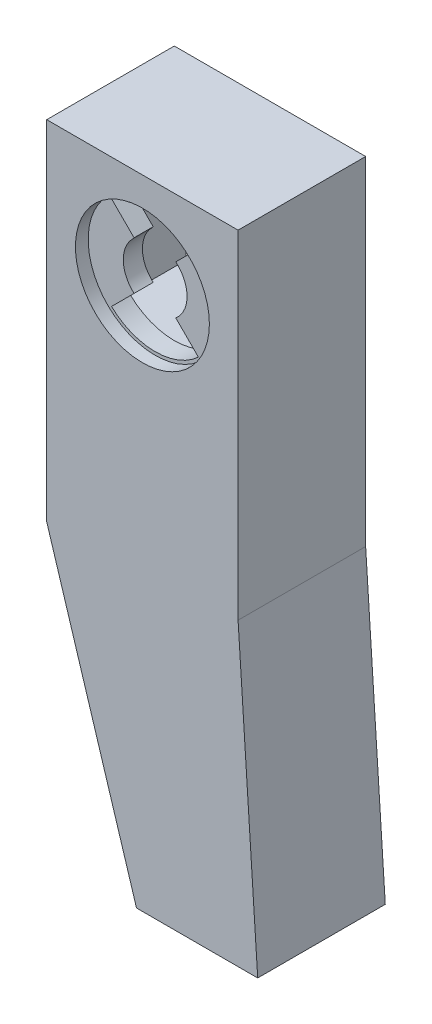
from build123d import *

# Parameters (mm, degrees)
SKETCH1_3_W         = 26.4
SKETCH1_3_H         = 26.4
BOSS_EXTRUDE3_DEPTH = 20
SKETCH1_10_W        = 26.4
SKETCH1_10_H        = 26.4
BOSS_EXTRUDE7_DEPTH = 5
SKETCH1_R           = 10.5
CUT_EXTRUDE1_DEPTH  = 2
SKETCH2_R           = 1.4
CUT_EXTRUDE2_DEPTH  = 15


with BuildPart() as part:
    # Sketch1<3> → Boss-Extrude3 (new body)
    with BuildSketch(Plane.XY):
        Polygon((-189.640703899, -24.770069728), (-175.564173506, -70.171428571), (-156.564173506, -70.171428571), (-159.640703899, -23.131847808), (-159.640703899, 29.828571429), (-189.640703899, 29.828571429), align=None)
        with Locations((-174.640703899, 14.828571429)):
            Rectangle(SKETCH1_3_W, SKETCH1_3_H, mode=Mode.SUBTRACT)
    extrude(amount=-BOSS_EXTRUDE3_DEPTH)

    # Sketch1<10> → Boss-Extrude7 (add)
    with BuildSketch(Plane.XY):
        with Locations((-174.640703899, 14.828571429)):
            Rectangle(SKETCH1_10_W, SKETCH1_10_H)
        with BuildLine():
            Line((-171.403251306, 11.018203899), (-167.861898306, 7.4768509))
            ThreePointArc((-167.861898306, 7.4768509), (-174.687644898, 4.828681602), (-181.488229417, 7.540814964))
            Line((-181.488229417, 7.540814964), (-177.949263698, 11.079780683))
            ThreePointArc((-177.949263698, 11.079780683), (-179.638278417, 14.672850745), (-178.176237805, 18.364105335))
            Line((-178.176237805, 18.364105335), (-177.949263698, 18.638938958))
            Line((-177.949263698, 18.638938958), (-181.456415012, 22.146090272))
            ThreePointArc((-181.456415012, 22.146090272), (-174.665862261, 24.828539781), (-167.861898306, 22.180291958))
            Line((-167.861898306, 22.180291958), (-171.403251306, 18.638938958))
            ThreePointArc((-171.403251306, 18.638938958), (-169.640703899, 14.828571429), (-171.403251306, 11.018203899))
        make_face(mode=Mode.SUBTRACT)
    extrude(amount=-BOSS_EXTRUDE7_DEPTH)

    # Sketch1 → Cut-Extrude1 (cut)
    with BuildSketch(Plane.XY):
        with Locations((-174.640703899, 14.828571429)):
            Circle(SKETCH1_R)
        with BuildLine():
            ThreePointArc((-171.403251306, 18.638938958), (-169.640703899, 14.828571429), (-171.403251306, 11.018203899))
            Line((-171.403251306, 11.018203899), (-167.861898306, 7.4768509))
            ThreePointArc((-167.861898306, 7.4768509), (-174.687644898, 4.828681602), (-181.488229417, 7.540814964))
            Line((-181.488229417, 7.540814964), (-177.949263698, 11.079780683))
            ThreePointArc((-177.949263698, 11.079780683), (-179.638278417, 14.672850745), (-178.176237805, 18.364105335))
            Line((-178.176237805, 18.364105335), (-177.949263698, 18.638938958))
            Line((-177.949263698, 18.638938958), (-181.456415012, 22.146090272))
            ThreePointArc((-181.456415012, 22.146090272), (-174.665862261, 24.828539781), (-167.861898306, 22.180291958))
            Line((-167.861898306, 22.180291958), (-171.403251306, 18.638938958))
        make_face(mode=Mode.SUBTRACT)
    extrude(amount=-CUT_EXTRUDE1_DEPTH, mode=Mode.SUBTRACT)

    # Sketch2 → Cut-Extrude2 (cut)
    with BuildSketch(Plane(origin=(0, -70.171428571, 0), x_dir=(-1, 0, 0), z_dir=(0, -1, 0))):
        with Locations((161.564173506, 12)):
            Circle(SKETCH2_R)
        with Locations((170.564173506, 12)):
            Circle(SKETCH2_R)
    extrude(amount=-CUT_EXTRUDE2_DEPTH, mode=Mode.SUBTRACT)


solid = part.part
